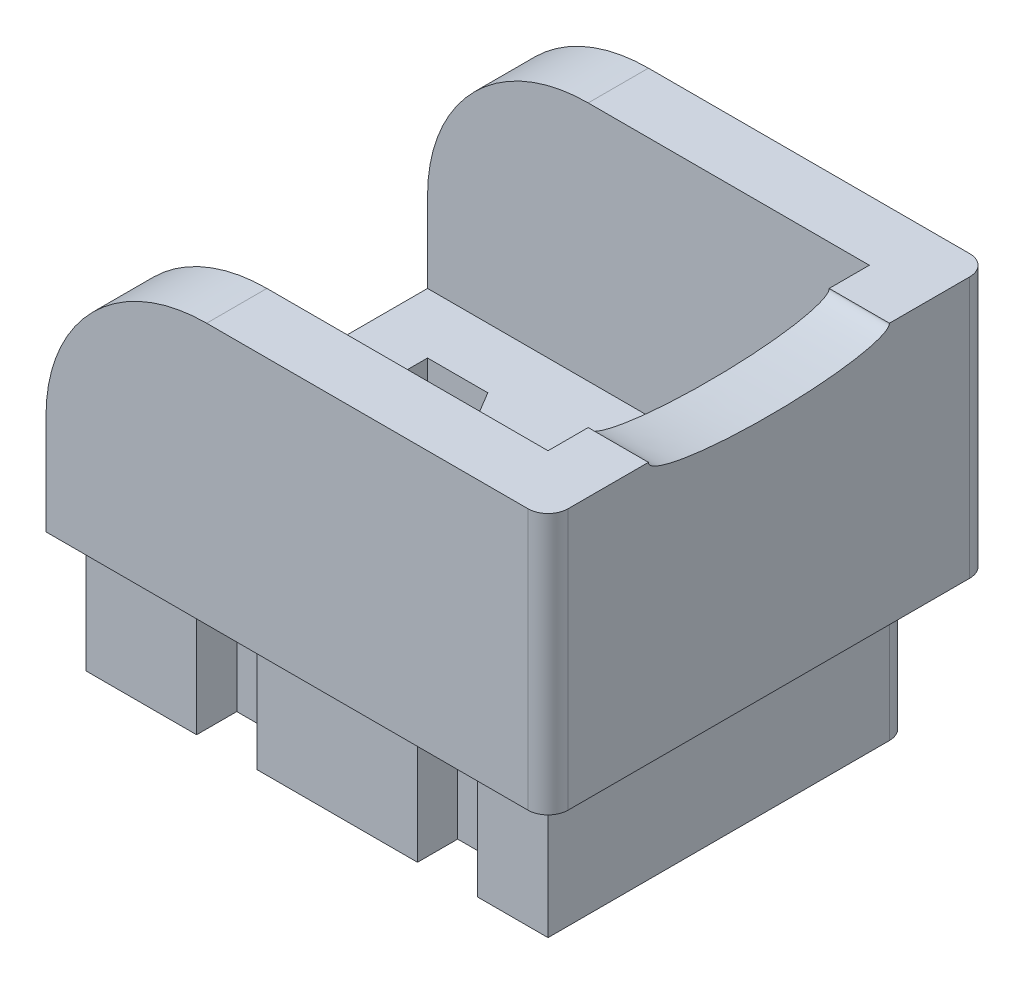
from build123d import *

# Parameters (mm, degrees)
BOSS_EXTRUDE2_DEPTH = 2
SKETCH8_R           = 0.46
CUT_EXTRUDE1_DEPTH  = 6.857687257
CUT_EXTRUDE3_DEPTH  = 5.308421985
BOSS_EXTRUDE3_DEPTH = 0.75
SKETCH11_W          = 5.5
SKETCH11_H          = 5
BOSS_EXTRUDE4_DEPTH = 0.75
FILLET1_R           = 2
CUT_EXTRUDE5_DEPTH  = 1.75
SKETCH13_W          = 0.75
SKETCH13_H          = 1.75
CUT_EXTRUDE4_DEPTH  = 0.5
FILLET2_R           = 0.25
FILLET3_R           = 0.25
SKETCH15_RX         = 1.5
SKETCH15_RY         = 0.25
CUT_EXTRUDE6_DEPTH  = 10


with BuildPart() as part:
    # Sketch5 → Boss-Extrude2 (new body)
    with BuildSketch(Plane(origin=(0, 0, 0), x_dir=(1, 0, 0), z_dir=(0, 1, 0))):
        Polygon((-2.25, -2), (1.75, -2), (3.25, -2), (3.25, 2), (1.75, 2), (-2.25, 2), align=None)
    extrude(amount=-BOSS_EXTRUDE2_DEPTH)

    # Sketch8 → Cut-Extrude1 (cut, through all)
    with BuildSketch(Plane(origin=(0.85, 2.55, 0), x_dir=(0.948683298050514, -0.3162277660168378, 0), z_dir=(0.3162277660168378, 0.948683298050514, 0))):
        with Locations((1.829822128, 0)):
            Circle(SKETCH8_R)
    extrude(amount=-CUT_EXTRUDE1_DEPTH, mode=Mode.SUBTRACT)

    # Sketch12 → Cut-Extrude3 (cut, through all)
    with BuildSketch(Plane(origin=(0, 0, 0), x_dir=(1, 0, 0), z_dir=(0, 1, 0))):
        Polygon((-1.5, 1.25), (-1.5, -1.25), (-0.75, -1.25), (0, 0), (-0.75, 1.25), align=None)
    extrude(amount=-CUT_EXTRUDE3_DEPTH, mode=Mode.SUBTRACT)

    # Sketch10 → Boss-Extrude3 (add)
    with BuildSketch(Plane.XY.offset(2)):
        Polygon((3.25, -2), (3.25, 3), (-2.25, 3), (-2.25, 0), (-2.25, -2), align=None)
    boss_extrude3 = extrude(amount=BOSS_EXTRUDE3_DEPTH)

    # Mirror1: Boss-Extrude3 across plane
    add(boss_extrude3.mirror(Plane.XY))

    # Sketch11 → Boss-Extrude4 (add)
    with BuildSketch(Plane(origin=(3.25, 0, 0), x_dir=(0, 0, -1), z_dir=(1, 0, 0))):
        with Locations((0, 0.5)):
            Rectangle(SKETCH11_W, SKETCH11_H)
    extrude(amount=BOSS_EXTRUDE4_DEPTH)

    # Fillet1
    fillet1_edges = [part.edges().sort_by_distance(p)[0] for p in [
        (-2.25, 3, 2.375),
        (-2.25, 3, -2.375),
    ]]
    fillet(fillet1_edges, radius=FILLET1_R)

    # Sketch14 → Cut-Extrude5 (cut)
    with BuildSketch(Plane.XZ.offset(2)):
        Polygon((-2.25, 2.75), (-2.25, 2.25), (3.5, 2.25), (3.5, -2.25), (-2.25, -2.25), (-2.25, -2.75), (4, -2.75), (4, 2.75), align=None)
    extrude(amount=-CUT_EXTRUDE5_DEPTH, mode=Mode.SUBTRACT)

    # Sketch13 → Cut-Extrude4 (cut)
    with BuildSketch(Plane.XY.offset(2.25)):
        with Locations((-0.5, -1.125)):
            Rectangle(SKETCH13_W, SKETCH13_H)
        with Locations((2.25, -1.125)):
            Rectangle(SKETCH13_W, SKETCH13_H)
    cut_extrude4 = extrude(amount=-CUT_EXTRUDE4_DEPTH, mode=Mode.SUBTRACT)

    # Mirror2: Cut-Extrude4 across plane
    add(cut_extrude4.mirror(Plane.XY), mode=Mode.SUBTRACT)

    # Fillet2
    fillet2_edges = [part.edges().sort_by_distance(p)[0] for p in [
        (3.0625, -0.25, -2.25),
        (3.5, -0.25, 0),
        (3.5, -1.125, -2.25),
        (-1.5625, -0.25, 2.25),
        (0.875, -0.25, 2.25),
        (3.0625, -0.25, 2.25),
        (0.875, -0.25, -2.25),
        (-1.5625, -0.25, -2.25),
    ]]
    fillet(fillet2_edges, radius=FILLET2_R)

    # Fillet3
    fillet3_edges = [part.edges().sort_by_distance(p)[0] for p in [
        (4, 1.375, -2.75),
        (4, 1.375, 2.75),
    ]]
    fillet(fillet3_edges, radius=FILLET3_R)

    # Sketch15 → Cut-Extrude6 (cut)
    with BuildSketch(Plane(origin=(4, 0, 0), x_dir=(0, 0, -1), z_dir=(1, 0, 0))):
        with Locations((0, 3)):
            Ellipse(SKETCH15_RX, SKETCH15_RY)
    extrude(amount=-CUT_EXTRUDE6_DEPTH, mode=Mode.SUBTRACT)


solid = part.part
